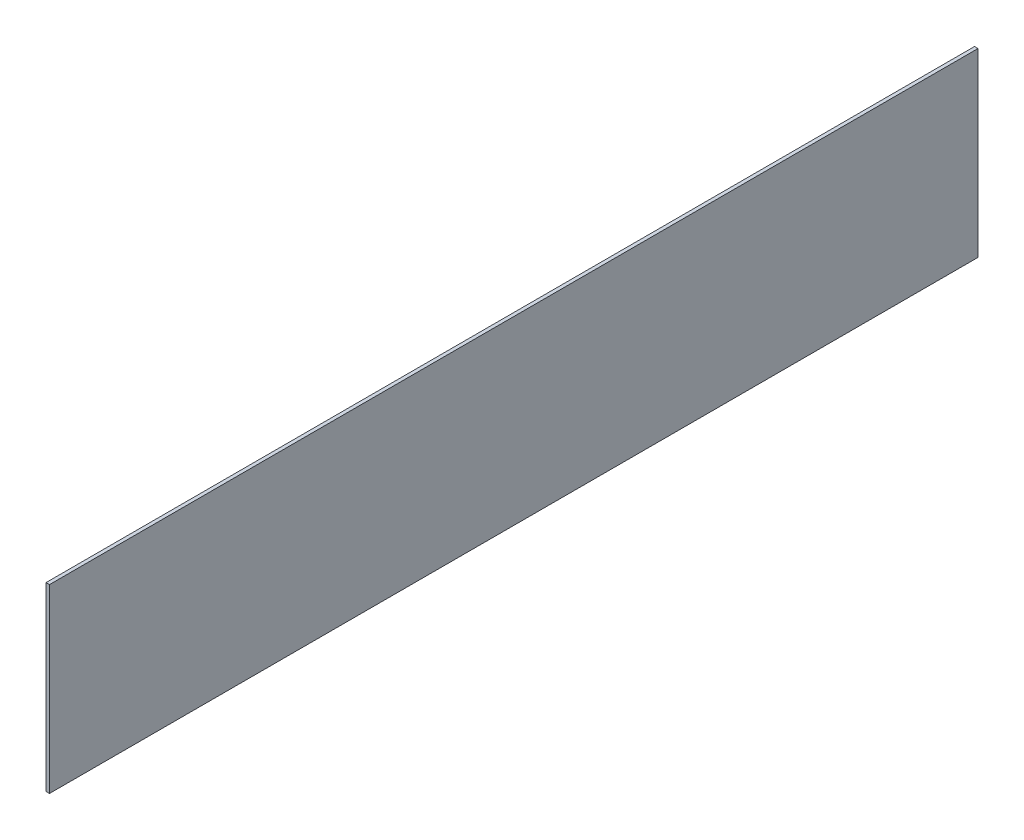
from build123d import *

# Parameters (mm, degrees)
SKETCH1_W           = 8006
SKETCH1_H           = 1560
BOSS_EXTRUDE1_DEPTH = 30


with BuildPart() as part:
    # Sketch1 → Boss-Extrude1 (new body)
    with BuildSketch(Plane(origin=(0, 0, 0), x_dir=(0, 0, -1), z_dir=(1, 0, 0))):
        with Locations((-4.983985884, 0.971148886)):
            Rectangle(SKETCH1_W, SKETCH1_H)
    extrude(amount=BOSS_EXTRUDE1_DEPTH)


solid = part.part
